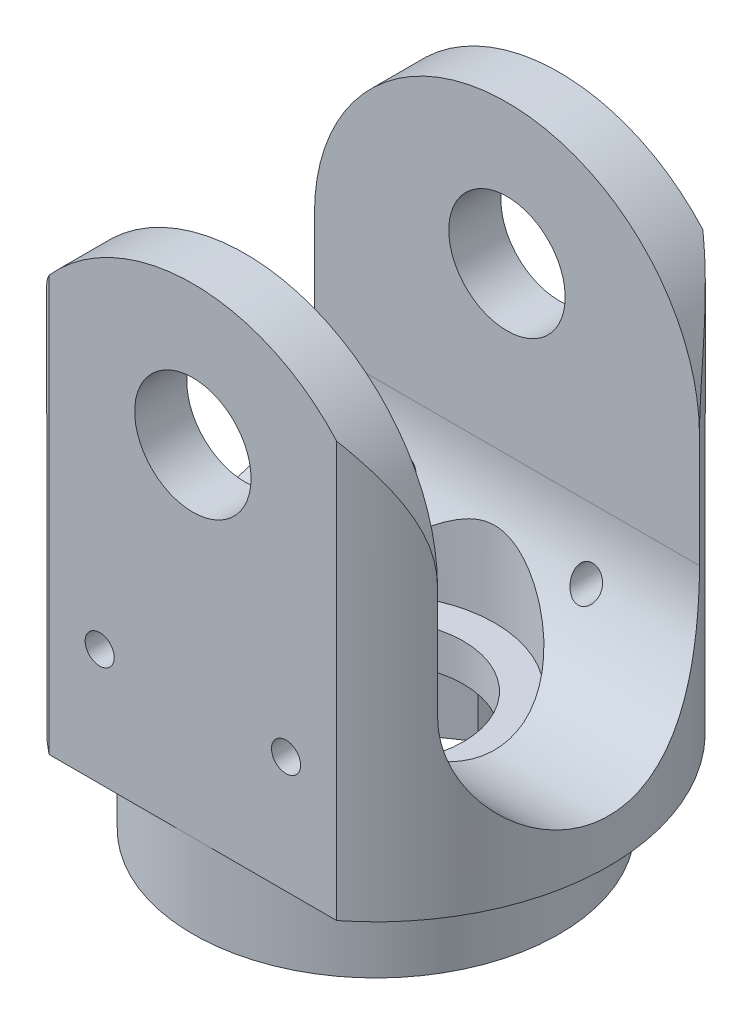
from build123d import *

# Parameters (mm, degrees)
BOSS_EXTRUDE1_DEPTH      = 15.367
BOSS_EXTRUDE1_DEPTH_BACK = 15.367
SKETCH1_R                = 12.7
SKETCH4_W                = 25.4
SKETCH4_H                = 30.734
CUT_EXTRUDE2_DEPTH       = 31.202731501
CUT_EXTRUDE3_DEPTH       = 23.298112478
CUT_EXTRUDE3_DEPTH_BACK  = 23.298112478
SKETCH5_W                = 14.2875
SKETCH5_H                = 16.637
CUT_EXTRUDE4_DEPTH       = 29.222672145
SKETCH7_R                = 4.7625
CUT_EXTRUDE5_DEPTH       = 35.722325639
SKETCH9_R                = 17.852773039
SKETCH9_R_2              = 9.9822
CUT_EXTRUDE6_DEPTH       = 4.572
SKETCH10_R               = 6.477
CUT_EXTRUDE7_DEPTH       = 24.257
SKETCH11_R               = 3.175
CUT_EXTRUDE8_DEPTH       = 29.222672145
CUT_EXTRUDE9_DEPTH       = 29.222672145
CUT_EXTRUDE9_DEPTH_BACK  = 29.222672145
SKETCH12_R               = 0.79375
SKETCH15_R               = 4.7625
CUT_EXTRUDE12_DEPTH      = 4.445
SKETCH16_R               = 1.5875
CUT_EXTRUDE13_DEPTH      = 4.445


with BuildPart() as part:
    # Sketch1 → Boss-Extrude1 (new, two sides: drawn at the far end of the back side and taken through both)
    with BuildSketch(Plane(origin=(0, 0, 0), x_dir=(1, 0, 0), z_dir=(0, 1, 0)).offset(-BOSS_EXTRUDE1_DEPTH_BACK)):
        with Locations(Location((0, 0, 0), (0, 0, 270))):
            Circle(SKETCH1_R)
    extrude(amount=BOSS_EXTRUDE1_DEPTH + BOSS_EXTRUDE1_DEPTH_BACK)

    # Sketch4 → Cut-Extrude2 (cut, through all)
    with BuildSketch(Plane.XY.offset(9.98855)):
        Rectangle(SKETCH4_W, SKETCH4_H)
    cut_extrude2 = extrude(amount=CUT_EXTRUDE2_DEPTH, mode=Mode.SUBTRACT)

    # Mirror2: Cut-Extrude2 across plane
    add(cut_extrude2.mirror(Plane.XY), mode=Mode.SUBTRACT)

    # Sketch5 → Cut-Extrude3 (cut, two sides: drawn at the far end of the back side and taken through both)
    with BuildSketch(Plane(origin=(0, 0, 0), x_dir=(0, 0, -1), z_dir=(1, 0, 0)).offset(-CUT_EXTRUDE3_DEPTH_BACK)):
        with Locations((0, 7.0485)):
            Rectangle(SKETCH5_W, SKETCH5_H)
        with BuildLine():
            Line((7.14375, -1.27), (-7.14375, -1.27))
            ThreePointArc((-7.14375, -1.27), (0, -8.41375), (7.14375, -1.27))
        make_face()
    extrude(amount=CUT_EXTRUDE3_DEPTH + CUT_EXTRUDE3_DEPTH_BACK, mode=Mode.SUBTRACT)

    # Sketch6 → Cut-Extrude4 (cut, through all)
    with BuildSketch(Plane.XY.offset(9.98855)):
        with BuildLine():
            ThreePointArc((7.843396515, 11.847950137), (9.813665145, 8.601547837), (10.50036, 4.86664))
            Line((10.50036, 4.86664), (14.849727138, 4.86664))
            ThreePointArc((14.849727138, 4.86664), (0, 19.716367138), (-14.849727138, 4.86664))
            Line((-14.849727138, 4.86664), (-10.50036, 4.86664))
            ThreePointArc((-10.50036, 4.86664), (-9.813665145, 8.601547837), (-7.843396515, 11.847950137))
            Line((-7.843396515, 11.847950137), (-7.843396515, 15.367))
            Line((-7.843396515, 15.367), (0, 15.367))
            Line((0, 15.367), (7.843396515, 15.367))
            Line((7.843396515, 15.367), (7.843396515, 11.847950137))
        make_face()
        with BuildLine():
            ThreePointArc((-7.843396515, 11.847950137), (-4.298330514, 14.446927831), (0, 15.367))
            Line((0, 15.367), (-7.843396515, 15.367))
            Line((-7.843396515, 15.367), (-7.843396515, 11.847950137))
        make_face()
        with BuildLine():
            ThreePointArc((0, 15.367), (4.298330514, 14.446927831), (7.843396515, 11.847950137))
            Line((7.843396515, 11.847950137), (7.843396515, 15.367))
            Line((7.843396515, 15.367), (0, 15.367))
        make_face()
    extrude(amount=-CUT_EXTRUDE4_DEPTH, mode=Mode.SUBTRACT)

    # Sketch7 → Cut-Extrude5 (cut, through all)
    with BuildSketch(Plane.XZ.offset(15.367)):
        with Locations(Location((0, 0, 0), (0, 0, 270))):
            Circle(SKETCH7_R)
    extrude(amount=-CUT_EXTRUDE5_DEPTH, mode=Mode.SUBTRACT)

    # Sketch9 → Cut-Extrude6 (cut)
    with BuildSketch(Plane.XZ.offset(15.367)):
        Circle(SKETCH9_R)
        with Locations(Location((0, 0, 0), (0, 0, 270))):
            Circle(SKETCH9_R_2, mode=Mode.SUBTRACT)
    extrude(amount=-CUT_EXTRUDE6_DEPTH, mode=Mode.SUBTRACT)

    # Sketch10 → Cut-Extrude7 (cut)
    with BuildSketch(Plane(origin=(0, 15.367, 0), x_dir=(1, 0, 0), z_dir=(0, 1, 0))):
        with Locations(Location((0, 0, 0), (0, 0, 270))):
            Circle(SKETCH10_R)
    extrude(amount=-CUT_EXTRUDE7_DEPTH, mode=Mode.SUBTRACT)

    # Sketch11 → Cut-Extrude8 (cut, through all)
    with BuildSketch(Plane.XY.offset(9.98855)):
        with Locations(Location((0, 7.747, 0), (0, 0, 270))):
            Circle(SKETCH11_R)
    extrude(amount=-CUT_EXTRUDE8_DEPTH, mode=Mode.SUBTRACT)

    # Sketch12 → Cut-Extrude9 (cut, two sides: drawn at the far end of the back side and taken through both)
    with BuildSketch(Plane(origin=(0, 0, -9.98855), x_dir=(-1, 0, 0), z_dir=(0, 0, -1)).offset(-CUT_EXTRUDE9_DEPTH_BACK)):
        with Locations((5.081146515, -4.445)):
            Circle(SKETCH12_R)
        with Locations((-5.081146515, -4.445)):
            Circle(SKETCH12_R)
    extrude(amount=CUT_EXTRUDE9_DEPTH + CUT_EXTRUDE9_DEPTH_BACK, mode=Mode.SUBTRACT)

    # Sketch15 → Cut-Extrude12 (cut)
    with BuildSketch(Plane.XZ.offset(15.367)):
        with BuildLine():
            ThreePointArc((8.001, 0), (-1.271072049, 7.899390916), (-7.597144444, -2.509860017))
            Line((-7.597144444, -2.509860017), (0.239879494, -7.997403255))
            ThreePointArc((0.239879494, -7.997403255), (5.741745241, -5.572105758), (8.001, 0))
        make_face()
        with Locations(Location((0, 0, 0), (0, 0, 270))):
            Circle(SKETCH15_R, mode=Mode.SUBTRACT)
    extrude(amount=-CUT_EXTRUDE12_DEPTH, mode=Mode.SUBTRACT)

    # Sketch16 → Cut-Extrude13 (cut)
    with BuildSketch(Plane.XZ.offset(15.367)):
        with Locations((-6.873606877, -2.270825729)):
            Circle(SKETCH16_R)
        with Locations((0.217023554, -7.235403255)):
            Circle(SKETCH16_R)
    extrude(amount=-CUT_EXTRUDE13_DEPTH, mode=Mode.SUBTRACT)


solid = part.part
